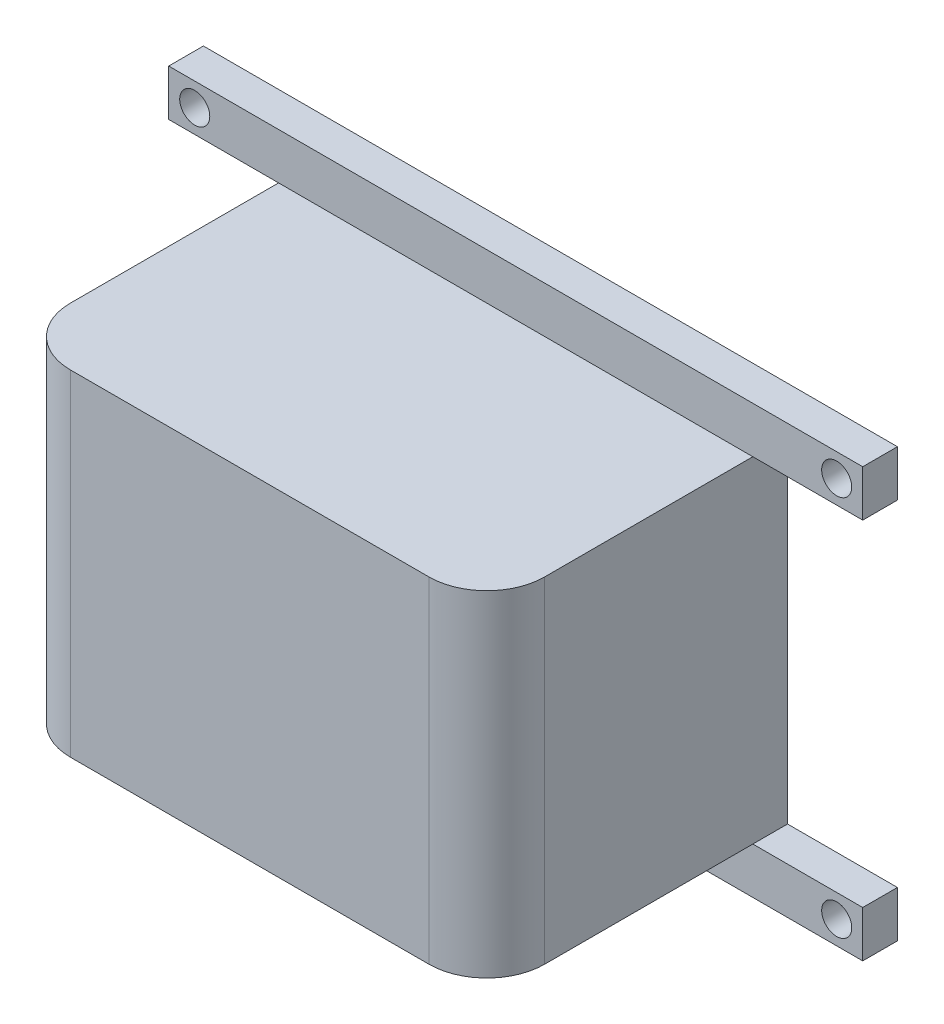
from build123d import *

# Parameters (mm, degrees)
BOSS_EXTRU_1_DEPTH           = 30
ENL_V_MAT_EXTRU_1_DEPTH      = 354.730123116
ENL_V_MAT_EXTRU_1_DEPTH_BACK = 354.730123116
ESQUISSE2_R                  = 13
ESQUISSE3_W                  = 410
ESQUISSE3_H                  = 290
BOSS_EXTRU_2_DEPTH           = 230
CONG_1_R                     = 50


with BuildPart() as part:
    # Esquisse1 → Boss.-Extru.1 (new body)
    with BuildSketch(Plane.XY):
        Polygon((300, 185), (-300, 185), (-300, 145), (-205, 145), (-205, -145), (-300, -145), (-300, -185), (300, -185), (300, -145), (205, -145), (205, 145), (300, 145), align=None)
    extrude(amount=BOSS_EXTRU_1_DEPTH)

    # Esquisse2 → Enlèv. mat.-Extru.1 (cut, two sides: drawn at the far end of the back side and taken through both)
    with BuildSketch(Plane.XY.offset(30).offset(-ENL_V_MAT_EXTRU_1_DEPTH_BACK)):
        with Locations((-277.5, 165)):
            Circle(ESQUISSE2_R)
        with Locations((277.5, 165)):
            Circle(ESQUISSE2_R)
        with Locations((277.5, -165)):
            Circle(ESQUISSE2_R)
        with Locations((-277.5, -165)):
            Circle(ESQUISSE2_R)
    extrude(amount=ENL_V_MAT_EXTRU_1_DEPTH + ENL_V_MAT_EXTRU_1_DEPTH_BACK, mode=Mode.SUBTRACT)

    # Esquisse3 → Boss.-Extru.2 (add)
    with BuildSketch(Plane.XY.offset(30)):
        Rectangle(ESQUISSE3_W, ESQUISSE3_H)
    extrude(amount=BOSS_EXTRU_2_DEPTH)

    # Congé1
    cong_1_edges = [part.edges().sort_by_distance(p)[0] for p in [
        (-205, 0, 260),
        (205, 0, 260),
    ]]
    fillet(cong_1_edges, radius=CONG_1_R)


solid = part.part
